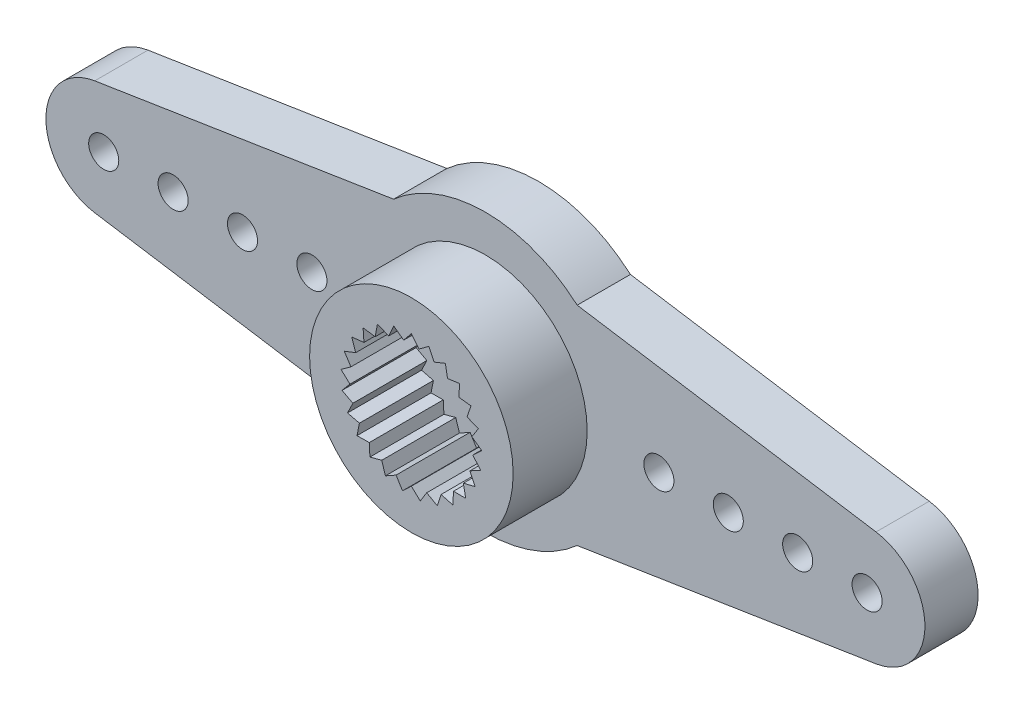
from build123d import *

# Parameters (mm, degrees)
SKETCH_1_R          = 0.65
SKETCH_1_R_2        = 1.5
EXTRUDE_1_DEPTH     = 2.3
SKETCH_2_R          = 4.4
EXTRUDE_2_DEPTH     = 3.2
SKETCH_3_R          = 4.4
SKETCH_3_R_2        = 3.4
SKETCH_3_R_3        = 2.75
SKETCH_3_R_4        = 1.5
CUT_EXTRUDE_1_DEPTH = 1


with BuildPart() as part:
    # Эскиз1 → Бобышка-Вытянуть1 (new body)
    with BuildSketch(Plane.XY):
        with BuildLine():
            Line((-3.968626967, 4.5), (-16.888114198, 2.469689731))
            ThreePointArc((-16.888114198, 2.469689731), (-19, 0), (-16.888114198, -2.469689731))
            Line((-16.888114198, -2.469689731), (-3.968626967, -4.5))
            ThreePointArc((-3.968626967, -4.5), (0, -6), (3.968626967, -4.5))
            Line((3.968626967, -4.5), (16.888114198, -2.469689731))
            ThreePointArc((16.888114198, -2.469689731), (19, 0), (16.888114198, 2.469689731))
            Line((16.888114198, 2.469689731), (3.968626967, 4.5))
            ThreePointArc((3.968626967, 4.5), (0, 6), (-3.968626967, 4.5))
        make_face()
        with Locations((-16.5, 0)):
            Circle(SKETCH_1_R, mode=Mode.SUBTRACT)
        with Locations((-13.5, 0)):
            Circle(SKETCH_1_R, mode=Mode.SUBTRACT)
        with Locations((-10.5, 0)):
            Circle(SKETCH_1_R, mode=Mode.SUBTRACT)
        with Locations((-7.5, 0)):
            Circle(SKETCH_1_R, mode=Mode.SUBTRACT)
        with Locations(Location((16.5, 0, 0), (0, 0, 180))):
            Circle(SKETCH_1_R, mode=Mode.SUBTRACT)
        with Locations(Location((7.5, 0, 0), (0, 0, 180))):
            Circle(SKETCH_1_R, mode=Mode.SUBTRACT)
        with Locations(Location((10.5, 0, 0), (0, 0, 180))):
            Circle(SKETCH_1_R, mode=Mode.SUBTRACT)
        with Locations(Location((13.5, 0, 0), (0, 0, 180))):
            Circle(SKETCH_1_R, mode=Mode.SUBTRACT)
        Circle(SKETCH_1_R_2, mode=Mode.SUBTRACT)
    extrude(amount=EXTRUDE_1_DEPTH)

    # Эскиз2 → Бобышка-Вытянуть2 (add)
    with BuildSketch(Plane.XY.offset(2.3)):
        with Locations(Location((0, 0, 0), (0, 0, 180))):
            Circle(SKETCH_2_R)
        Polygon((0.333439775, 2.639447604), (0, 3.05), (-0.333439775, 2.639447604), (-0.758504156, 2.954178641), (-0.979368078, 2.473601404), (-1.469348706, 2.672735374), (-1.563759083, 2.15232973), (-2.087868673, 2.223354314), (-2.049893354, 1.695819264), (-2.575200173, 1.634271725), (-2.407225286, 1.132754236), (-2.900722375, 0.942501833), (-2.6133024, 0.498514094), (-3.043981522, 0.191511085), (-2.655176114, -0.167049522), (-2.995976115, -0.571513009), (-2.530215347, -0.822116802), (-2.75972251, -1.298626839), (-2.246271844, -1.42552746), (-2.35006539, -1.944143169), (-1.821186821, -1.939366985), (-1.792745019, -2.467501833), (-1.281669931, -2.33134895), (-1.122779886, -2.835818282), (-0.661621006, -2.576843686), (-0.382266362, -3.025949839), (0, -2.660425857), (0.382266362, -3.025949839), (0.661621006, -2.576843686), (1.122779886, -2.835818282), (1.281669931, -2.33134895), (1.792745019, -2.467501833), (1.821186821, -1.939366985), (2.35006539, -1.944143169), (2.246271844, -1.42552746), (2.75972251, -1.298626839), (2.530215347, -0.822116802), (2.995976115, -0.571513009), (2.655176114, -0.167049522), (3.043981522, 0.191511085), (2.6133024, 0.498514094), (2.900722375, 0.942501833), (2.407225286, 1.132754236), (2.575200173, 1.634271725), (2.049893354, 1.695819264), (2.087868673, 2.223354314), (1.563759083, 2.15232973), (1.469348706, 2.672735374), (0.979368078, 2.473601404), (0.758504156, 2.954178641), align=None, mode=Mode.SUBTRACT)
    extrude(amount=EXTRUDE_2_DEPTH)

    # Эскиз3 → Вырез-Вытянуть1 (cut)
    # profile 1 of 2: a face of its own
    with BuildSketch(Plane(origin=(0, 0, 0), x_dir=(-1, 0, 0), z_dir=(0, 0, -1))):
        Circle(SKETCH_3_R)
        Circle(SKETCH_3_R_2, mode=Mode.SUBTRACT)
    # profile 2 of 2: a face of its own
    with BuildSketch(Plane(origin=(0, 0, 0), x_dir=(-1, 0, 0), z_dir=(0, 0, -1))):
        Circle(SKETCH_3_R_3)
        Circle(SKETCH_3_R_4, mode=Mode.SUBTRACT)
    extrude(amount=-CUT_EXTRUDE_1_DEPTH, mode=Mode.SUBTRACT)


solid = part.part
